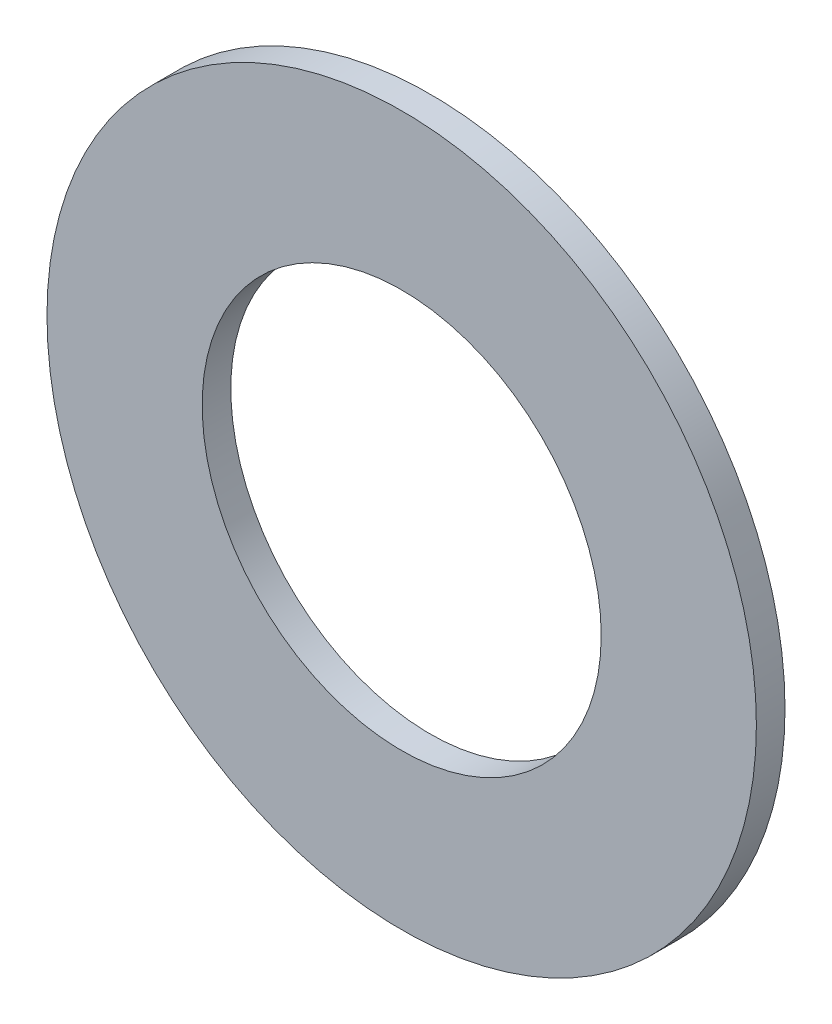
from build123d import *

# Parameters (mm, degrees)
BOSS_EXTRUDE1_DEPTH      = 1.025
BOSS_EXTRUDE1_DEPTH_BACK = 1.025
SKETCH3_R                = 25.4
SKETCH3_R_2              = 14.2875


with BuildPart() as part:
    # Sketch3 → Boss-Extrude1 (new, two sides: drawn at the far end of the back side and taken through both)
    with BuildSketch(Plane.XY.offset(-BOSS_EXTRUDE1_DEPTH_BACK)):
        Circle(SKETCH3_R)
        Circle(SKETCH3_R_2, mode=Mode.SUBTRACT)
    extrude(amount=BOSS_EXTRUDE1_DEPTH + BOSS_EXTRUDE1_DEPTH_BACK)


solid = part.part
